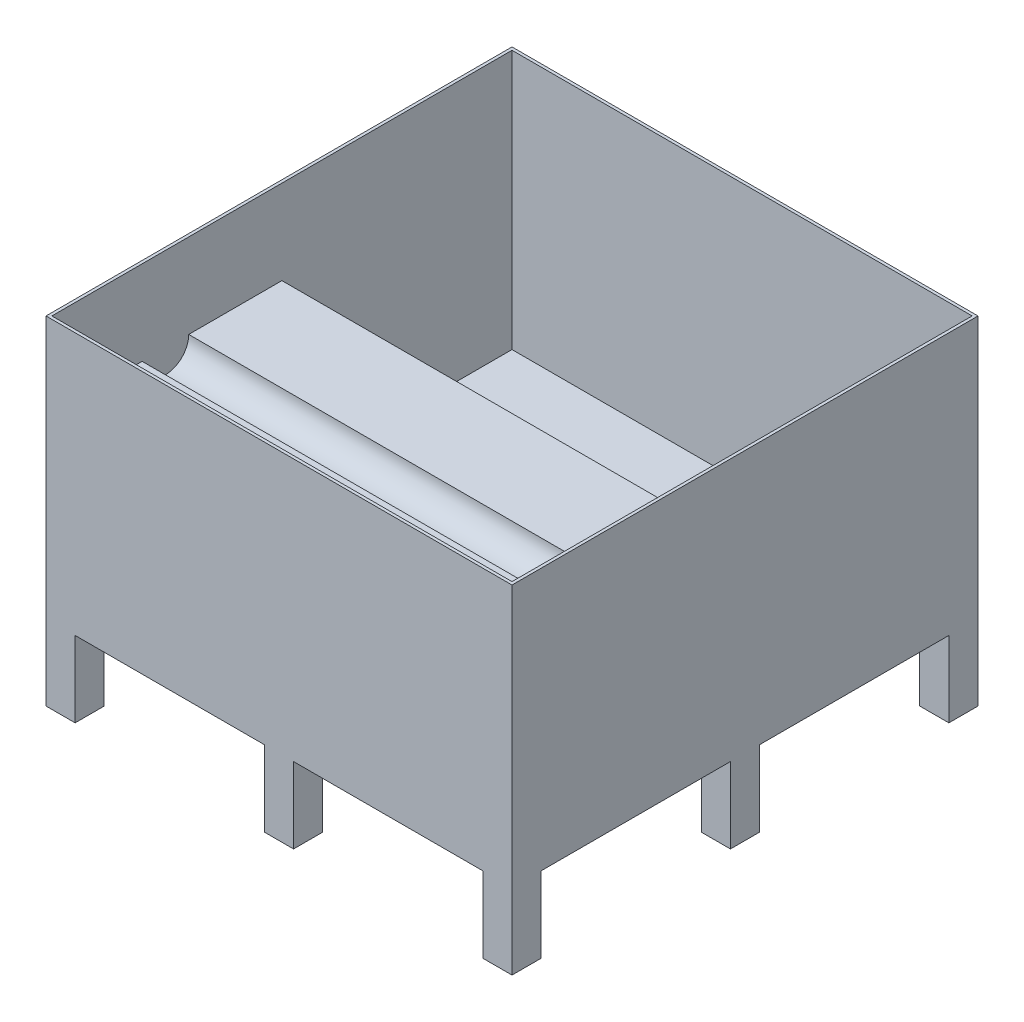
from build123d import *

# Parameters (mm, degrees)
SKETCH1_W           = 800
SKETCH1_H           = 800
BOSS_EXTRUDE1_DEPTH = 450
SHELL1_T            = -5
SKETCH2_W           = 790
SKETCH2_H           = 395
BOSS_EXTRUDE2_DEPTH = 300
CUT_EXTRUDE1_START  = -5
SKETCH3_R           = 40
CUT_EXTRUDE1_DEPTH  = 790
SKETCH4_W           = 50
SKETCH4_H           = 50
BOSS_EXTRUDE3_DEPTH = 130


with BuildPart() as part:
    # Sketch1 → Boss-Extrude1 (new body)
    with BuildSketch(Plane(origin=(0, 0, 0), x_dir=(1, 0, 0), z_dir=(0, 1, 0))):
        with Locations((400, -400)):
            Rectangle(SKETCH1_W, SKETCH1_H)
    extrude(amount=BOSS_EXTRUDE1_DEPTH)

    # Shell1
    shell1_openings = [part.faces().sort_by_distance(p)[0] for p in [
        (400, 450, 400),
    ]]
    offset(amount=SHELL1_T, openings=shell1_openings, kind=Kind.INTERSECTION)

    # Sketch2 → Boss-Extrude2 (add)
    with BuildSketch(Plane(origin=(0, 5, 0), x_dir=(1, 0, 0), z_dir=(0, 1, 0))):
        with Locations((400, -597.5)):
            Rectangle(SKETCH2_W, SKETCH2_H)
    extrude(amount=BOSS_EXTRUDE2_DEPTH)

    # Sketch3 → Cut-Extrude1 (cut)
    with BuildSketch(Plane(origin=(800, 0, 0), x_dir=(0, 0, -1), z_dir=(1, 0, 0)).offset(CUT_EXTRUDE1_START)):
        with Locations((-600, 305)):
            Circle(SKETCH3_R)
    extrude(amount=-CUT_EXTRUDE1_DEPTH, mode=Mode.SUBTRACT)

    # Sketch4 → Boss-Extrude3 (add)
    with BuildSketch(Plane.XZ):
        with Locations((25, 775)):
            Rectangle(SKETCH4_W, SKETCH4_H)
        with Locations((400, 775)):
            Rectangle(SKETCH4_W, SKETCH4_H)
        with Locations((775, 775)):
            Rectangle(SKETCH4_W, SKETCH4_H)
        with Locations((400, 400)):
            Rectangle(SKETCH4_W, SKETCH4_H)
        with Locations((775, 400)):
            Rectangle(SKETCH4_W, SKETCH4_H)
        with Locations((400, 25)):
            Rectangle(SKETCH4_W, SKETCH4_H)
        with Locations((775, 25)):
            Rectangle(SKETCH4_W, SKETCH4_H)
        with Locations((25, 400)):
            Rectangle(SKETCH4_W, SKETCH4_H)
        with Locations((25, 25)):
            Rectangle(SKETCH4_W, SKETCH4_H)
    extrude(amount=BOSS_EXTRUDE3_DEPTH)


solid = part.part
